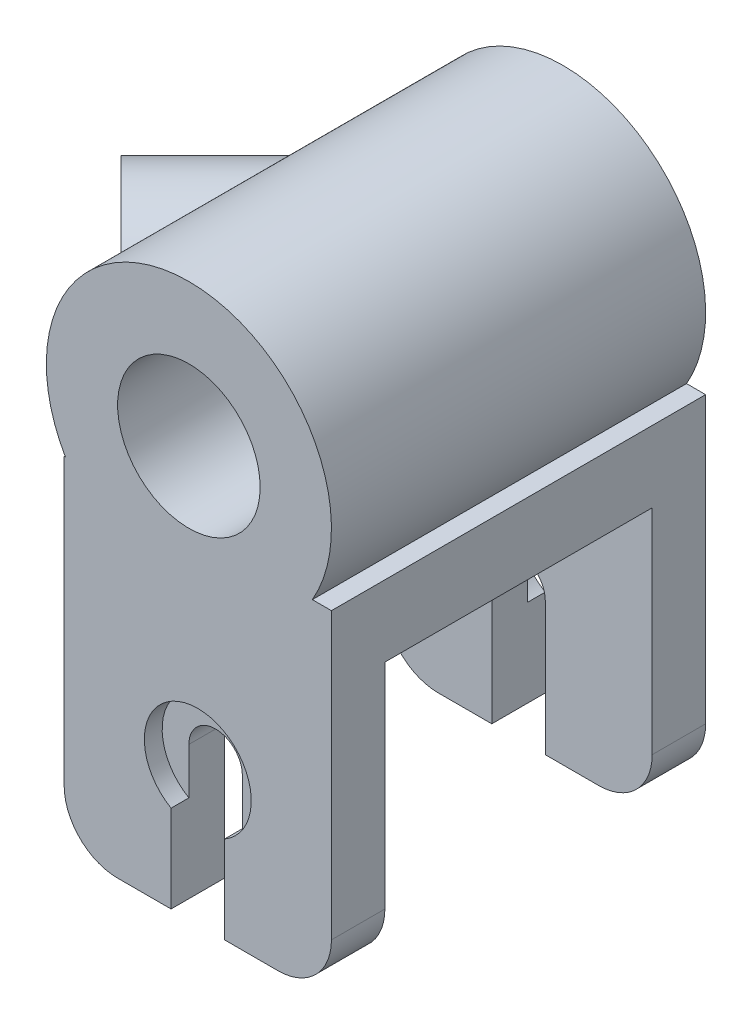
from build123d import *

# Parameters (mm, degrees)
SKETCH1_R           = 4
BOSS_EXTRUDE1_DEPTH = 21
SKETCH3_W           = 15
SKETCH3_H           = 3
BOSS_EXTRUDE2_DEPTH = 15
SKETCH4_R           = 3
CUT_EXTRUDE1_DEPTH  = 1
SKETCH5_R           = 1.5
CUT_EXTRUDE2_DEPTH  = 4
FILLET1_R           = 3
CUT_EXTRUDE3_START  = -27
SKETCH7_R           = 4
CUT_EXTRUDE3_DEPTH  = 27
SKETCH8_R           = 1.5
CUT_EXTRUDE4_DEPTH  = 14
CUT_EXTRUDE5_DEPTH  = 2.5
SKETCH10_R          = 5
CUT_EXTRUDE6_DEPTH  = 7.5


with BuildPart() as part:
    # Sketch1 → Boss-Extrude1 (new body)
    with BuildSketch(Plane.XY):
        with BuildLine():
            ThreePointArc((6.92820323, -4), (0, 8), (-6.92820323, -4))
            Line((-6.92820323, -4), (-7, -4))
            Line((-7, -4), (-7, -8))
            Line((-7, -8), (8, -8))
            Line((8, -8), (8, -4))
            Line((8, -4), (6.92820323, -4))
        make_face()
        with Locations(Location((0, 0, 0), (0, 0, 180))):
            Circle(SKETCH1_R, mode=Mode.SUBTRACT)
    extrude(amount=BOSS_EXTRUDE1_DEPTH)

    # Sketch3 → Boss-Extrude2 (add)
    with BuildSketch(Plane.XZ.offset(8)):
        with Locations((0.5, 19.5)):
            Rectangle(SKETCH3_W, SKETCH3_H)
        with Locations((0.5, 1.5)):
            Rectangle(SKETCH3_W, SKETCH3_H)
    extrude(amount=BOSS_EXTRUDE2_DEPTH)

    # Sketch4 → Cut-Extrude1 (cut)
    with BuildSketch(Plane.XY.offset(21)):
        with Locations((0.5, -15.5)):
            Circle(SKETCH4_R)
    cut_extrude1 = extrude(amount=-CUT_EXTRUDE1_DEPTH, mode=Mode.SUBTRACT)

    # Sketch5 → Cut-Extrude2 (cut, symmetric)
    with BuildSketch(Plane.XY.offset(20)):
        with Locations((0.5, -15.5)):
            Circle(SKETCH5_R)
        with BuildLine():
            Line((2, -18.098076211), (2, -15.5))
            ThreePointArc((2, -15.5), (0.5, -17), (-1, -15.5))
            Line((-1, -15.5), (-1, -18.098076211))
            ThreePointArc((-1, -18.098076211), (0.5, -18.5), (2, -18.098076211))
        make_face()
        with BuildLine():
            Line((2, -23), (2, -18.098076211))
            ThreePointArc((2, -18.098076211), (0.5, -18.5), (-1, -18.098076211))
            Line((-1, -18.098076211), (-1, -23))
            Line((-1, -23), (2, -23))
        make_face()
    cut_extrude2 = extrude(amount=CUT_EXTRUDE2_DEPTH, both=True, mode=Mode.SUBTRACT)

    # Mirror1: Cut-Extrude1, Cut-Extrude2 across plane
    add(cut_extrude1.mirror(Plane.XY.offset(10.5)), mode=Mode.SUBTRACT)
    add(cut_extrude2.mirror(Plane.XY.offset(10.5)), mode=Mode.SUBTRACT)

    # Fillet1
    fillet1_edges = [part.edges().sort_by_distance(p)[0] for p in [
        (8, -23, 19.5),
        (-7, -23, 19.5),
        (8, -23, 1.5),
        (-7, -23, 1.5),
    ]]
    fillet(fillet1_edges, radius=FILLET1_R)

    # Sketch6 → Revolve1 (revolve)
    with BuildSketch(Plane(origin=(0, 0, 0), x_dir=(1, 0, 0), z_dir=(0, 1, 0))):
        Polygon((-9.899494937, -14.899494937), (-6.363961031, -18.435028843), (0, -12.071067812), (-3.535533906, -8.535533906), align=None)
    revolve(axis=Axis((0, 0, 5), (-0.7071067811865487, 0, 0.7071067811865465)))

    # Sketch7 → Cut-Extrude3 (cut)
    with BuildSketch(Plane.XY.offset(21).offset(CUT_EXTRUDE3_START)):
        with Locations(Location((0, 0, 0), (0, 0, 180))):
            Circle(SKETCH7_R)
    extrude(amount=CUT_EXTRUDE3_DEPTH, mode=Mode.SUBTRACT)

    # Sketch8 → Cut-Extrude4 (cut)
    with BuildSketch(Plane(origin=(-12.399494937, 0, 12.399494937), x_dir=(0.7071067811865464, 0, 0.7071067811865487), z_dir=(-0.7071067811865487, 0, 0.7071067811865464))):
        with Locations((3.535533906, 0)):
            Circle(SKETCH8_R)
    extrude(amount=-CUT_EXTRUDE4_DEPTH, mode=Mode.SUBTRACT)

    # Sketch9 → Cut-Extrude5 (cut)
    with BuildSketch(Plane(origin=(-10.278174593, 0, 10.278174593), x_dir=(0.7071067811865464, 0, 0.7071067811865487), z_dir=(-0.7071067811865487, 0, 0.7071067811865464))):
        Polygon((1.918953152, -2.8), (5.15211466, -2.8), (6.768695413, 0), (5.15211466, 2.8), (1.918953152, 2.8), (0.302372398, 0), align=None)
        Polygon((-2.926090212, -2.8), (-2.926090212, 2.8), (1.918953152, 2.8), (0.302372398, 0), (1.918953152, -2.8), align=None)
    extrude(amount=-CUT_EXTRUDE5_DEPTH, mode=Mode.SUBTRACT)

    # Sketch10 → Cut-Extrude6 (cut)
    with BuildSketch(Plane(origin=(-12.399494937, 0, 12.399494937), x_dir=(0.7071067811865464, 0, 0.7071067811865487), z_dir=(-0.7071067811865487, 0, 0.7071067811865464))):
        with Locations((3.535533906, 0)):
            Circle(SKETCH10_R)
    extrude(amount=CUT_EXTRUDE6_DEPTH, mode=Mode.SUBTRACT)


solid = part.part
